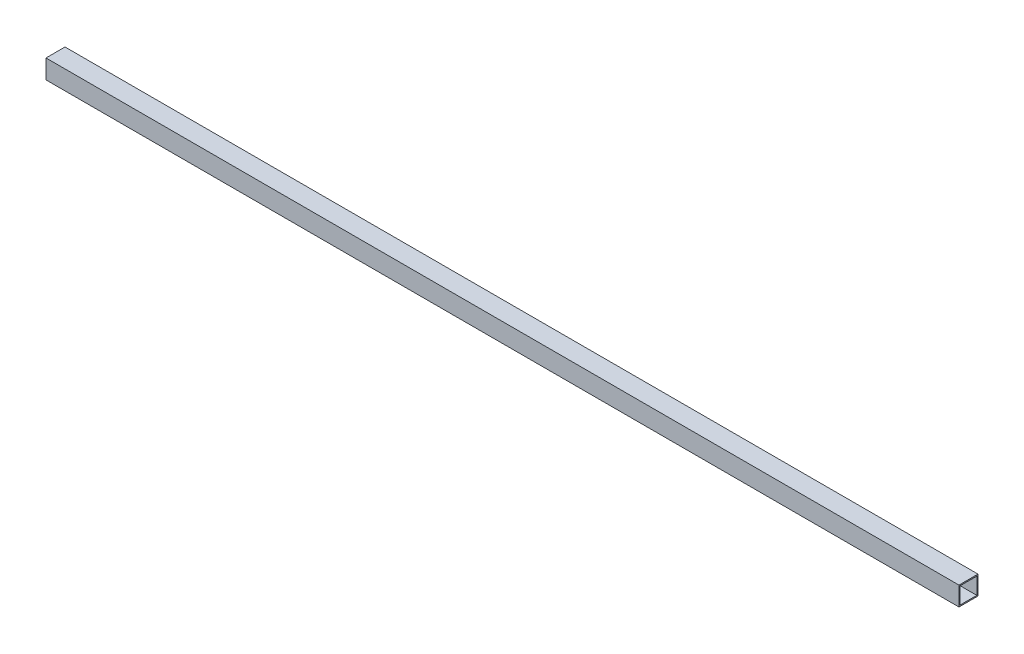
from build123d import *

# Parameters (mm, degrees)
SKETCH1_W           = 25.4
SKETCH1_H           = 25.4
SKETCH1_W_2         = 22.225
SKETCH1_H_2         = 22.225
BOSS_EXTRUDE1_DEPTH = 1219.2


with BuildPart() as part:
    # Sketch1 → Boss-Extrude1 (new body)
    with BuildSketch(Plane(origin=(0, 0, 0), x_dir=(0, 0, -1), z_dir=(1, 0, 0))):
        Rectangle(SKETCH1_W, SKETCH1_H)
        Rectangle(SKETCH1_W_2, SKETCH1_H_2, mode=Mode.SUBTRACT)
    extrude(amount=BOSS_EXTRUDE1_DEPTH)


solid = part.part
